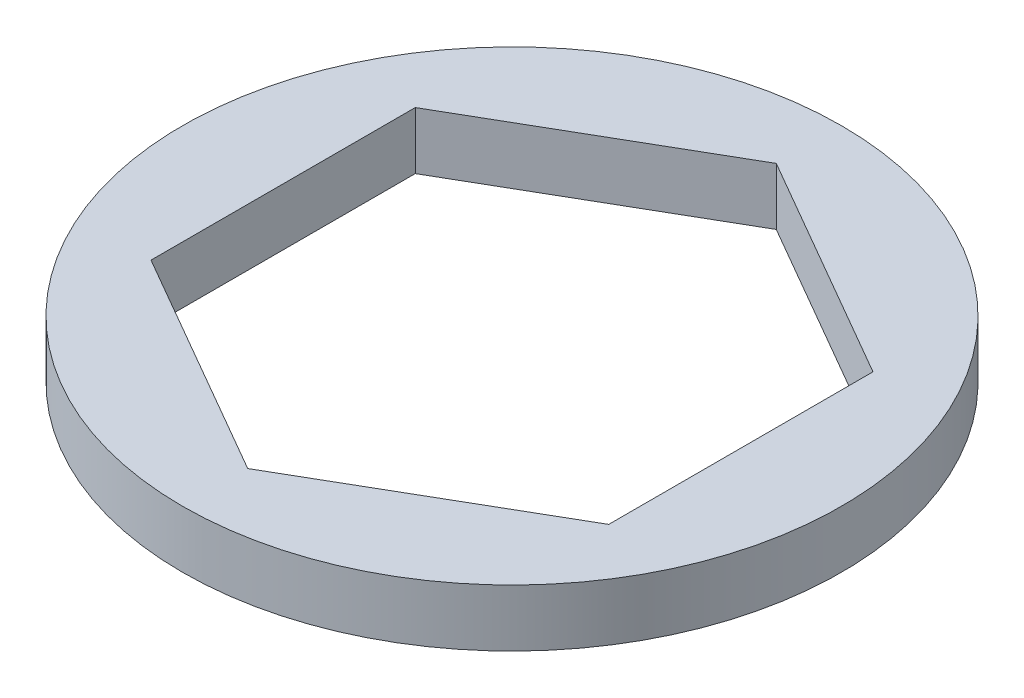
from build123d import *

# Parameters (mm, degrees)
SKETCH1_R           = 9.144
BOSS_EXTRUDE1_DEPTH = 1.5875


with BuildPart() as part:
    # Sketch1 → Boss-Extrude1 (new body)
    with BuildSketch(Plane(origin=(0, 0, 0), x_dir=(1, 0, 0), z_dir=(0, 1, 0))):
        with Locations(Location((0, 0, 0), (0, 0, 270))):
            Circle(SKETCH1_R)
        Polygon((6.35, -3.666174209), (6.35, 3.666174209), (0, 7.332348419), (-6.35, 3.666174209), (-6.35, -3.666174209), (0, -7.332348419), align=None, mode=Mode.SUBTRACT)
    extrude(amount=BOSS_EXTRUDE1_DEPTH)


solid = part.part
